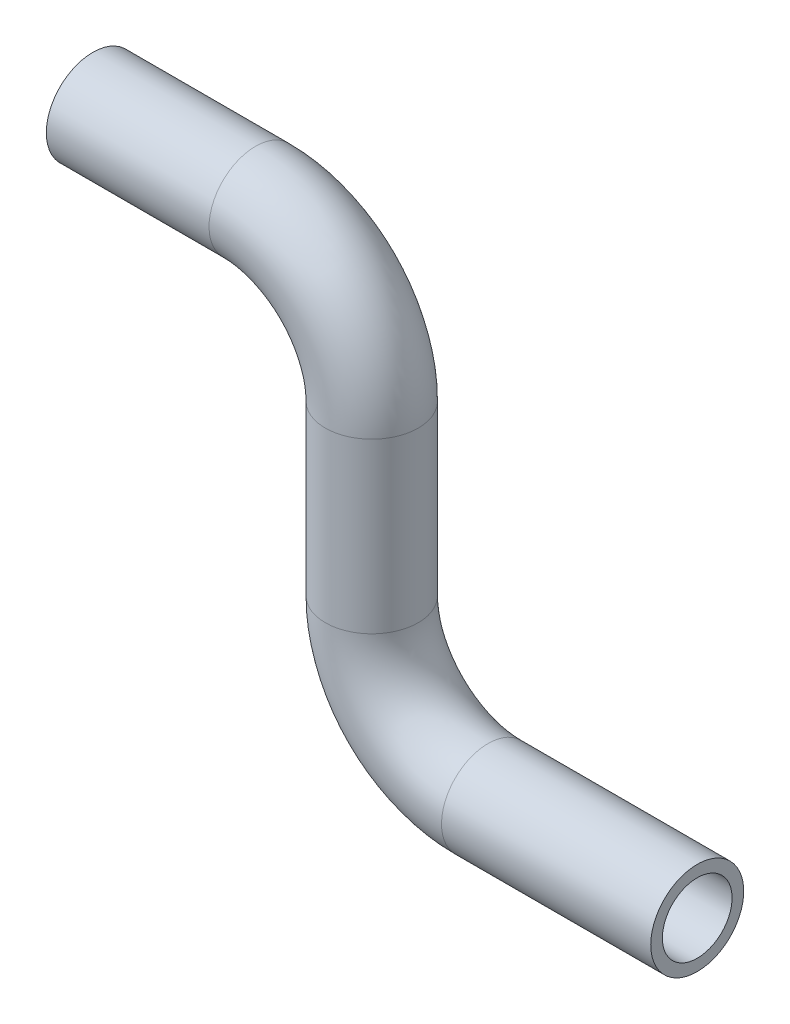
from build123d import *

# Parameters (mm, degrees)
TUBE_PROFILE_R   = 4
TUBE_PROFILE_R_2 = 3


with BuildPart() as part:
    # Tube: sweep along a curve in space
    with BuildLine() as tube_path:
        Line((28, 55.5, 95), (42, 55.5, 95))
        ThreePointArc((52, 45.5, 95), (49.071067812, 52.571067812, 95), (42, 55.5, 95))
        Line((52, 45.5, 95), (52, 31, 95))
        ThreePointArc((62, 21, 95), (54.928932188, 23.928932188, 95), (52, 31, 95))
        Line((62, 21, 95), (80, 21, 95))
    # Tube profile (on start of the path) → Tube (sweep)
    with BuildSketch(Plane(origin=(28, 55.5, 95), x_dir=(0, 0, 1), z_dir=(1, 0, 0))):
        Circle(TUBE_PROFILE_R)
        Circle(TUBE_PROFILE_R_2, mode=Mode.SUBTRACT)
    sweep(path=tube_path.line)


solid = part.part
